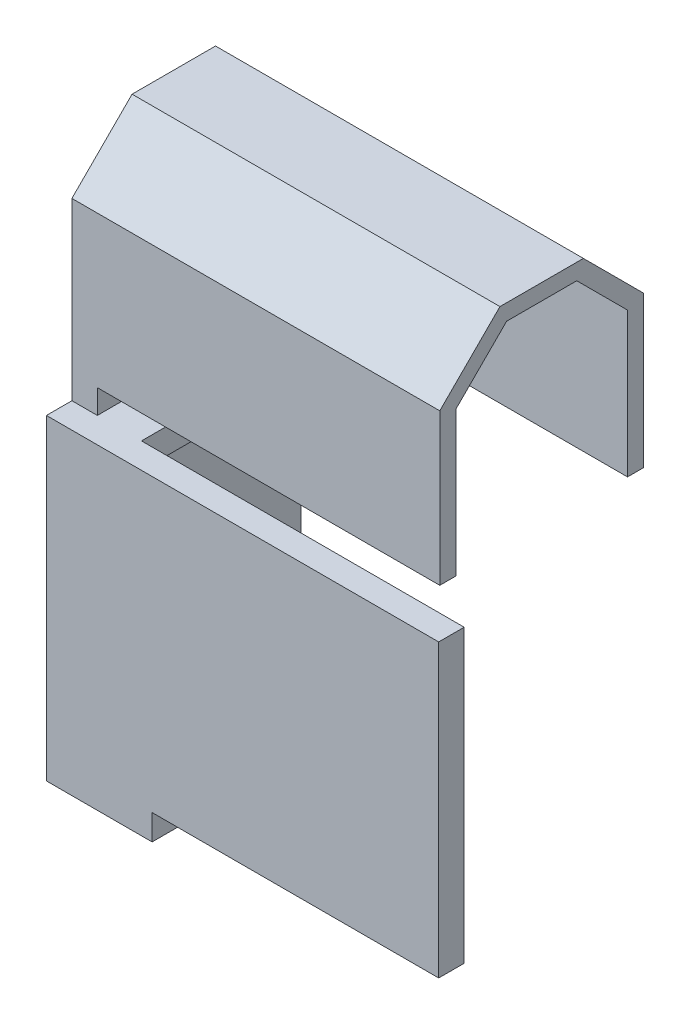
from build123d import *

# Parameters (mm, degrees)
SKETCH1_R            = 3
BOSS_EXTRUDE1_DEPTH  = 3.175
BOSS_EXTRUDE2_DEPTH  = 8.5
SKETCH3_R            = 7
BOSS_EXTRUDE3_DEPTH  = 3.175
SKETCH4_W            = 3.171981578
SKETCH4_H            = 25.4
BOSS_EXTRUDE4_DEPTH  = 42.45
SKETCH5_R            = 5
SKETCH5_R_2          = 3
BOSS_EXTRUDE5_DEPTH  = 5
CHAMFER2_SIZE        = 7.5
SKETCH7_W            = 25.4
SKETCH7_H            = 3.175
BOSS_EXTRUDE6_DEPTH  = 5.5
SKETCH9_W            = 25.4
SKETCH9_H            = 3.175
BOSS_EXTRUDE7_DEPTH  = 10
BOSS_EXTRUDE8_DEPTH  = 31
BOSS_EXTRUDE11_DEPTH = 3.175


with BuildPart() as part:
    # Sketch1 → Boss-Extrude1 (new body)
    with BuildSketch(Plane(origin=(0, 0, 0), x_dir=(0, 0, -1), z_dir=(1, 0, 0))):
        Polygon((-12.7, 12.7), (-12.7, 0), (-12.7, -13.638521551), (12.7, -13.638521551), (12.7, 0), (12.7, 12.7), align=None)
        Circle(SKETCH1_R, mode=Mode.SUBTRACT)
    extrude(amount=BOSS_EXTRUDE1_DEPTH)

    # Sketch2 → Boss-Extrude2 (add)
    with BuildSketch(Plane.ZY):
        Polygon((-10.7, -11.638521551), (-10.7, -13.638521551), (-12.7, -13.638521551), (-12.7, 12.7), (12.7, 12.7), (12.7, -13.638521551), (10.7, -13.638521551), (10.7, -11.638521551), (10.7, 10.7), (-10.7, 10.7), align=None)
    extrude(amount=BOSS_EXTRUDE2_DEPTH)

    # Sketch3 → Boss-Extrude3 (add)
    with BuildSketch(Plane.ZY.offset(8.5)):
        Polygon((-10.7, -13.638521551), (10.7, -13.638521551), (12.7, -13.638521551), (12.7, 12.7), (-12.7, 12.7), (-12.7, -13.638521551), align=None)
        Circle(SKETCH3_R, mode=Mode.SUBTRACT)
    extrude(amount=BOSS_EXTRUDE3_DEPTH)

    # Sketch4 → Boss-Extrude4 (add)
    with BuildSketch(Plane.XZ.offset(13.638521551)):
        with Locations((-10.089009211, 0)):
            Rectangle(SKETCH4_W, SKETCH4_H)
    extrude(amount=BOSS_EXTRUDE4_DEPTH)

    # Sketch5 → Boss-Extrude5 (add)
    with BuildSketch(Plane(origin=(3.175, 0, 0), x_dir=(0, 0, -1), z_dir=(1, 0, 0))):
        Circle(SKETCH5_R)
        Circle(SKETCH5_R_2, mode=Mode.SUBTRACT)
    extrude(amount=BOSS_EXTRUDE5_DEPTH)

    # Chamfer2
    chamfer2_edges = [part.edges().sort_by_distance(p)[0] for p in [
        (-4.25, 12.7, 12.7),
        (-4.25, 12.7, -12.7),
        (-4.25, 10.7, -10.7),
        (-4.25, 10.7, 10.7),
    ]]
    chamfer(chamfer2_edges, length=CHAMFER2_SIZE)

    # Sketch7 → Boss-Extrude6 (add)
    with BuildSketch(Plane(origin=(-8.503018422, 0, 0), x_dir=(0, 0, -1), z_dir=(1, 0, 0))):
        with Locations((0, -18.226021551)):
            Rectangle(SKETCH7_W, SKETCH7_H)
    extrude(amount=BOSS_EXTRUDE6_DEPTH)

    # Sketch9 → Boss-Extrude7 (add)
    with BuildSketch(Plane(origin=(-8.503018422, 0, 0), x_dir=(0, 0, -1), z_dir=(1, 0, 0))):
        with Locations((0, -54.501021551)):
            Rectangle(SKETCH9_W, SKETCH9_H)
    extrude(amount=BOSS_EXTRUDE7_DEPTH)

    # Sketch10 → Boss-Extrude8 (add)
    with BuildSketch(Plane(origin=(3.175, 0, 0), x_dir=(0, 0, -1), z_dir=(1, 0, 0))):
        Polygon((5.2, 12.7), (-5.2, 12.7), (-12.7, 5.2), (-12.7, -13.638521551), (-10.7, -13.638521551), (-10.7, -11.638521551), (-10.7, 4.371572875), (-4.371572875, 10.7), (4.371572875, 10.7), (10.7, 4.371572875), (10.7, -11.638521551), (10.7, -13.638521551), (12.7, -13.638521551), (12.7, 5.2), align=None)
    extrude(amount=BOSS_EXTRUDE8_DEPTH)

    # Sketch12 → Boss-Extrude11 (add)
    with BuildSketch(Plane.XY.offset(12.7)):
        Polygon((-11.675, -52.913521551), (-11.675, -56.088521551), (1.496981578, -56.088521551), (1.496981578, -52.913521551), (37.215, -52.913521551), (37.215, -16.638521551), (-11.675, -16.638521551), align=None)
    extrude(amount=BOSS_EXTRUDE11_DEPTH)


solid = part.part
